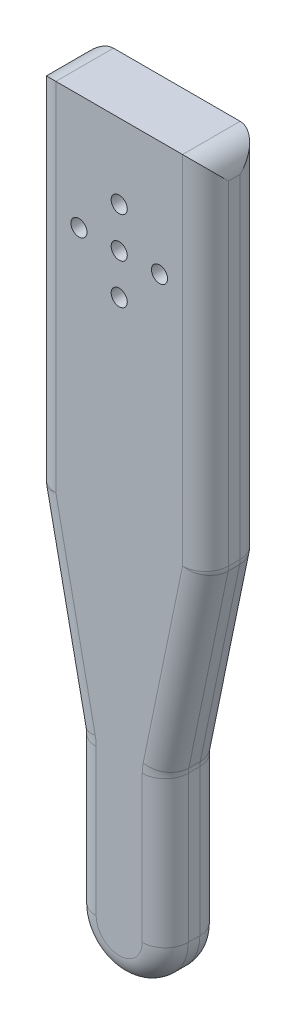
from build123d import *

# Parameters (mm, degrees)
SKETCH2_W           = 30
SKETCH2_H           = 130
BOSS_EXTRUDE1_DEPTH = 10
CUT_EXTRUDE3_DEPTH  = 75.64013832
FILLET3_RADIUS      = 8
FILLET3_LENGTH      = 10
FILLET4_R           = 4
SKETCH3_R           = 1.4
CUT_EXTRUDE4_DEPTH  = 75.64013841


with BuildPart() as part:
    # Sketch2 → Boss-Extrude1 (new body)
    with BuildSketch(Plane.XY):
        with Locations((-14.802371542, -2.697628458)):
            Rectangle(SKETCH2_W, SKETCH2_H)
    extrude(amount=BOSS_EXTRUDE1_DEPTH)

    # Sketch6 → Cut-Extrude3 (cut, through all)
    with BuildSketch(Plane.XY.offset(10)):
        Polygon((-29.802371542, -67.697628458), (-22.802371542, -67.697628458), (-22.802371542, -33.848814229), (-29.802371542, 0), align=None)
        Polygon((0.197628458, -67.697628458), (-6.802371542, -67.697628458), (-6.802371542, -33.848814229), (0.197628458, 0), align=None)
    extrude(amount=-CUT_EXTRUDE3_DEPTH, mode=Mode.SUBTRACT)

    # Fillet3: full round fillet: the end face becomes a half cylinder, R = half its width
    fillet3_face = Plane((-14.802371542, -67.697628458, 5), x_dir=(0, 0, 1), z_dir=(0, -1, 0))  # on the end face: x along it, z out of the body
    fillet3_slab = fillet3_face.offset(-FILLET3_RADIUS / 2) * Box(FILLET3_LENGTH, 2 * FILLET3_RADIUS, FILLET3_RADIUS, mode=Mode.PRIVATE)  # the body's end, R deep
    fillet3_round = Plane((-14.802371542, -59.697628458, 5), x_dir=(0, -1, 0), z_dir=(0, 0, 1)) * Cylinder(FILLET3_RADIUS, FILLET3_LENGTH, mode=Mode.PRIVATE)  # its axis R under the face
    add(fillet3_slab - fillet3_round, mode=Mode.SUBTRACT)

    # Fillet4
    fillet4_edges = [part.edges().sort_by_distance(p)[0] for p in [
        (0.197628458, 31.151185771, 0),
        (0.197628458, 31.151185771, 10),
        (-3.302371542, -16.924407115, 10),
        (-6.802371542, -33.848814229, 5),
        (0.197628458, 0, 5),
        (-3.302371542, -16.924407115, 0),
        (-26.302371542, -16.924407115, 10),
        (-29.802371542, 0, 5),
        (-22.802371542, -33.848814229, 5),
        (-26.302371542, -16.924407115, 0),
        (-22.802371542, -46.773221344, 10),
        (-22.802371542, -46.773221344, 0),
        (-6.802371542, -46.773221344, 10),
        (-6.802371542, -46.773221344, 0),
        (-14.802371542, -67.697628458, 0),
        (-14.802371542, -67.697628458, 10),
        (-29.802371542, 31.151185771, 10),
        (-29.802371542, 31.151185771, 0),
        (-29.802371542, 62.302371542, 5),
        (0.197628458, 62.302371542, 5),
    ]]
    fillet(fillet4_edges, radius=FILLET4_R)

    # Sketch3 → Cut-Extrude4 (cut, through all)
    with BuildSketch(Plane.XY.offset(10)):
        with Locations((-21.802371542, 42.302371542)):
            Circle(SKETCH3_R)
        with Locations((-14.802371542, 49.302371542)):
            Circle(SKETCH3_R)
        with Locations((-7.802371542, 42.302371542)):
            Circle(SKETCH3_R)
        with Locations((-14.802371542, 35.302371542)):
            Circle(SKETCH3_R)
        with Locations((-14.802371542, 42.302371542)):
            Circle(SKETCH3_R)
    extrude(amount=-CUT_EXTRUDE4_DEPTH, mode=Mode.SUBTRACT)


solid = part.part
